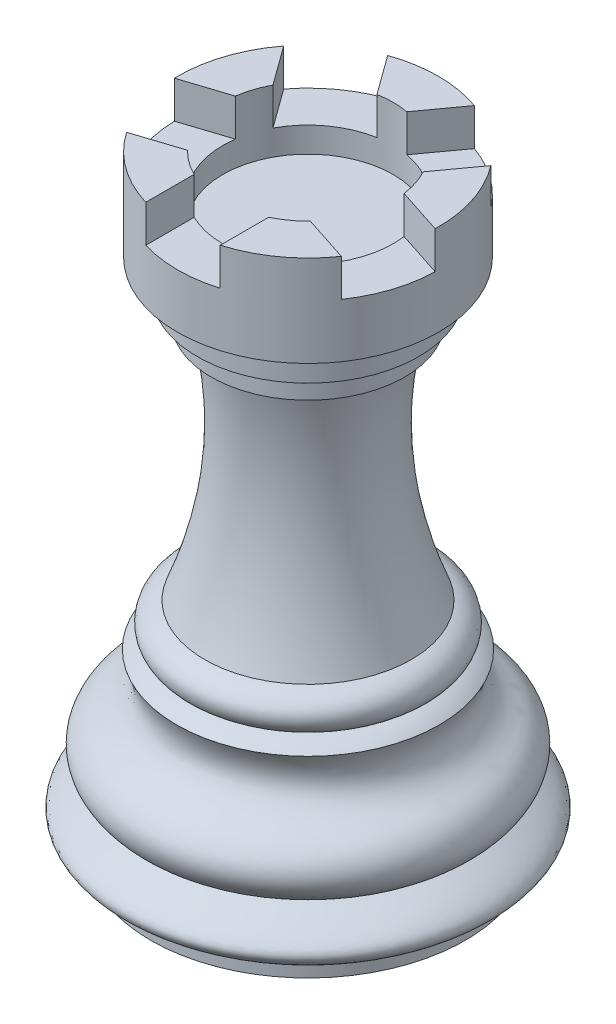
from build123d import *

# Parameters (mm, degrees)
CUT_EXTRUDE1_REACH      = 583.154
CUT_EXTRUDE1_END_RADIUS = 115.042183374
SKETCH2_W               = 65.664640974
SKETCH2_H               = 32.867618056
CIRPATTERN1_COUNT       = 5
SCALE1_SCALE            = 0.5


with BuildPart() as part:
    # Sketch1 → Revolve3 (revolve)
    with BuildSketch(Plane.XY, mode=Mode.PRIVATE) as revolve3_sk:
        with BuildLine():
            Line((-75.145058725, 533.150129184), (-115.042183374, 533.150129184))
            Line((-115.042183374, 533.150129184), (-115.042183374, 452.605501163))
            Line((-115.042183374, 452.605501163), (-104.764120477, 452.605501163))
            add(Edge.make_bspline(
                [(-97.51690324, 440.631837901), (-98.128887476, 451.378771981), (-101.685246118, 452.080665565), (-104.764120477, 452.605501163)],
                knots=[0, 0, 0, 0, 1, 1, 1, 1], degree=3))
            Line((-97.51690324, 440.631837901), (-97.51690324, 425.192114221))
            add(Edge.make_bspline(
                [(-85.228143577, 416.369414976), (-84.936752466, 423.927754756), (-97.51690324, 425.192114221)],
                knots=[0, 0, 0, 1, 1, 1], degree=2))
            Line((-85.228143577, 416.369414976), (-85.228143577, 403.45046251))
            Line((-85.228143577, 403.45046251), (-75.145058725, 403.45046251))
            Line((-75.145058725, 403.45046251), (-75.145058725, 397.77872728))
            Line((-75.145058725, 397.77872728), (-71.950499182, 397.77872728))
            add(Edge.make_bspline(
                [(-71.950499182, 397.77872728), (-50.350281599, 296.008581386), (-91.082413904, 190.58582726)],
                knots=[0, 0, 0, 1, 1, 1], degree=2))
            add(Edge.make_bspline(
                [(-91.082413904, 190.58582726), (-112.660551902, 184.536501847), (-111.40301421, 167.650949366), (-100.689501264, 160.76852346)],
                knots=[0, 0, 0, 0, 1, 1, 1, 1], degree=3))
            add(Edge.make_bspline(
                [(-100.689501264, 160.76852346), (-108.824232173, 158.389917951), (-115.79853462, 153.084543009)],
                knots=[0, 0, 0, 1, 1, 1], degree=2))
            add(Edge.make_bspline(
                [(-115.79853462, 153.084543009), (-107.72227996, 137.586500479), (-104.646040508, 118.842015382), (-145.304529398, 100.022777628), (-157.954487397, 76.978809099), (-138.696019347, 57.775154709), (-130.88975824, 55.780575157)],
                knots=[0, 0, 0, 0, 0.533072535, 0.60626625, 0.825963286, 1, 1, 1, 1], degree=3))
            add(Edge.make_bspline(
                [(-130.88975824, 55.780575157), (-177.281947757, 34.378728382), (-168.943379536, 29.48016461), (-138.750576901, 10.783413117)],
                knots=[0, 0, 0, 0, 1, 1, 1, 1], degree=3))
            Line((-138.750576901, 10.783413117), (-138.750576901, 0))
            Line((-138.750576901, 0), (0, 0))
            Line((0, 0), (0, 478.063206489))
            Line((0, 478.063206489), (-75.145058725, 478.063206489))
            Line((-75.145058725, 478.063206489), (-75.145058725, 533.150129184))
        make_face()
    revolve(revolve3_sk.sketch.rotate(Axis((0, 0, 0), (0, 1, 0)), 270), axis=Axis((0, 0, 0), (0, 1, 0)))

    # Cut-Extrude1: up to this cylinder (the profile starts inside it)
    cut_extrude1_end = Plane(origin=(0, 516.71632, 0), z_dir=(0, -1, 0)) * Cylinder(CUT_EXTRUDE1_END_RADIUS, 1397.392366748, mode=Mode.PRIVATE)
    # Sketch2 → Cut-Extrude1 (cut, up to the surface)
    with BuildSketch(Plane.XY, mode=Mode.PRIVATE) as cut_extrude1_sk1:
        with Locations((0, 516.716320156)):
            Rectangle(SKETCH2_W, SKETCH2_H)
    cut_extrude1_tool1 = extrude(cut_extrude1_sk1.sketch, amount=CUT_EXTRUDE1_REACH, mode=Mode.PRIVATE) & cut_extrude1_end
    cut_extrude1 = cut_extrude1_tool1.solids().sort_by_distance((0, 516.71632, 0))[0]
    add(cut_extrude1, mode=Mode.SUBTRACT)

    # CirPattern1: Cut-Extrude1 ×5 about axis
    cirpattern1_axis = Axis((0, 0, 0), (0, 1, 0))
    for i in range(1, CIRPATTERN1_COUNT):
        add(cut_extrude1.rotate(cirpattern1_axis, i * 360 / CIRPATTERN1_COUNT), mode=Mode.SUBTRACT)


with BuildPart() as part_1:
    # Scale1: scaled about (0, 0, 0)
    add(part.part.scale(SCALE1_SCALE))


solid = part_1.part
